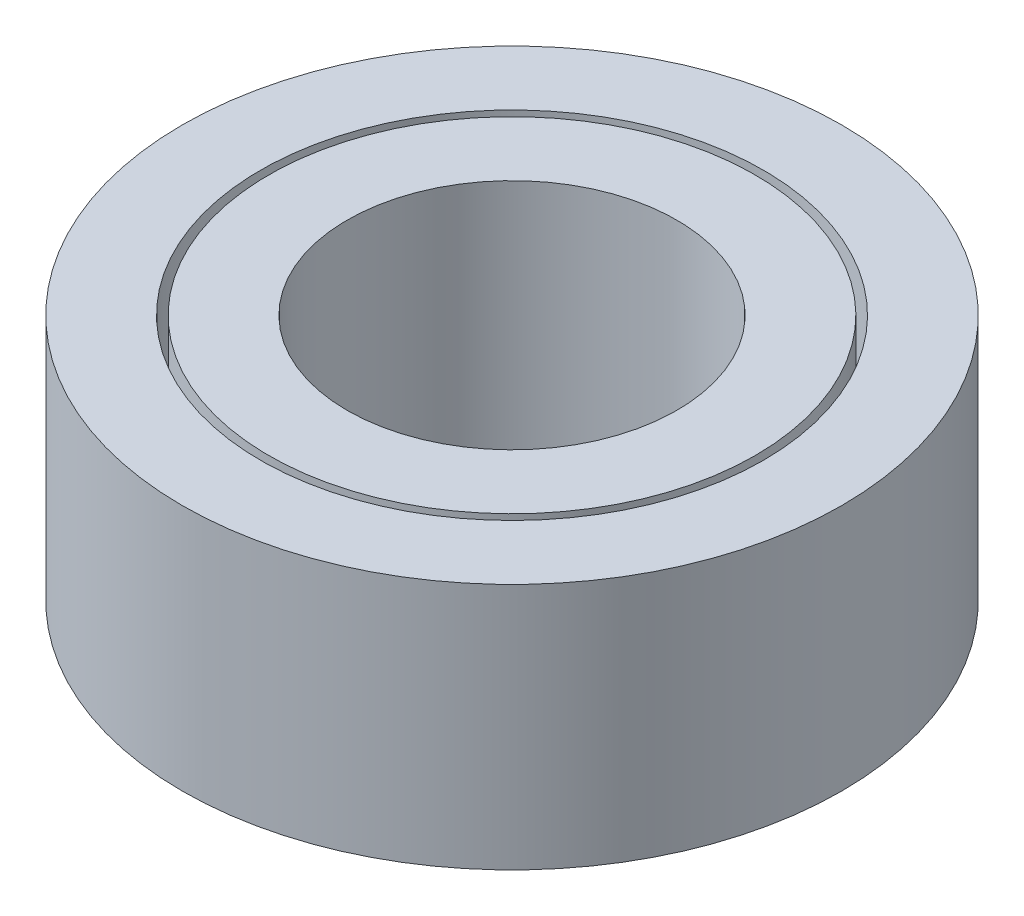
from build123d import *

# Parameters (mm, degrees)
SKETCH_1_R          = 4
SKETCH_1_R_2        = 3
EXTRUDE_1_DEPTH     = 3
SKETCH_1_3_R        = 3
SKETCH_1_3_R_2      = 2
EXTRUDE_2_DEPTH     = 3
SKETCH_1_5_R        = 3.05
SKETCH_1_5_R_2      = 2.95
CUT_EXTRUDE_2_DEPTH = 3


with BuildPart() as part:
    # 草图1 → 凸台-拉伸1 (new body)
    with BuildSketch(Plane(origin=(0, 0, 0), x_dir=(1, 0, 0), z_dir=(0, 1, 0))):
        Circle(SKETCH_1_R)
        Circle(SKETCH_1_R_2, mode=Mode.SUBTRACT)
    extrude(amount=EXTRUDE_1_DEPTH)

    # 草图1<3> → 凸台-拉伸2 (add)
    with BuildSketch(Plane(origin=(0, 0, 0), x_dir=(1, 0, 0), z_dir=(0, 1, 0))):
        Circle(SKETCH_1_3_R)
        Circle(SKETCH_1_3_R_2, mode=Mode.SUBTRACT)
    extrude(amount=EXTRUDE_2_DEPTH)

    # 草图1<5> → 切除-拉伸-薄壁2 (cut)
    with BuildSketch(Plane(origin=(0, 0, 0), x_dir=(1, 0, 0), z_dir=(0, 1, 0))):
        Circle(SKETCH_1_5_R)
        Circle(SKETCH_1_5_R_2, mode=Mode.SUBTRACT)
    extrude(amount=CUT_EXTRUDE_2_DEPTH, mode=Mode.SUBTRACT)


with BuildPart() as cut_extrude_2_piece_1:
    # of the separate pieces the step leaves, piece 1, a body of its own (cut_extrude_2_pieces)
    add(part.part.solids().sort_by_distance((4, 0, 0))[0])


with BuildPart() as cut_extrude_2_piece_2:
    # of the separate pieces the step leaves, piece 2, a body of its own (cut_extrude_2_pieces)
    add(part.part.solids().sort_by_distance((2.95, 0, 0))[0])


solid = Compound([cut_extrude_2_piece_1.part, cut_extrude_2_piece_2.part])
